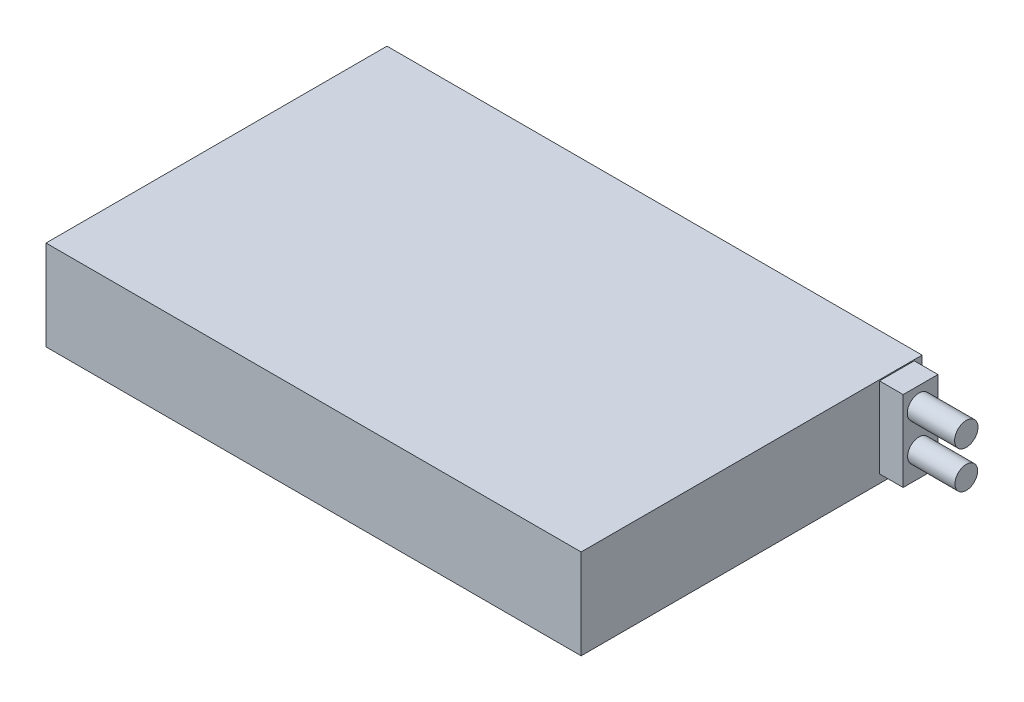
from build123d import *

# Parameters (mm, degrees)
SKETCH_1_W      = 113
SKETCH_1_H      = 72
EXTRUDE_1_DEPTH = 19
SKETCH_2_W      = 7.344019186
SKETCH_2_H      = 17.001907431
EXTRUDE_2_DEPTH = 5
SKETCH_3_R      = 2.471853224
SKETCH_3_R_2    = 2.395721662
EXTRUDE_3_DEPTH = 10


with BuildPart() as part:
    # 草图1 → 凸台-拉伸1 (new body)
    with BuildSketch(Plane(origin=(0, 0, 0), x_dir=(1, 0, 0), z_dir=(0, 1, 0))):
        with Locations((56.5, -36)):
            Rectangle(SKETCH_1_W, SKETCH_1_H)
    extrude(amount=EXTRUDE_1_DEPTH)

    # 草图2 → 凸台-拉伸2 (add)
    with BuildSketch(Plane(origin=(113, 0, 0), x_dir=(0, 0, -1), z_dir=(1, 0, 0))):
        with Locations((-5.329755024, 10.281536394)):
            Rectangle(SKETCH_2_W, SKETCH_2_H)
    extrude(amount=EXTRUDE_2_DEPTH)

    # 草图3 → 凸台-拉伸3 (add)
    with BuildSketch(Plane(origin=(118, 0, 0), x_dir=(0, 0, -1), z_dir=(1, 0, 0))):
        with Locations((-5.672341685, 14.927563873)):
            Circle(SKETCH_3_R)
        with Locations((-5.672341685, 6.978123812)):
            Circle(SKETCH_3_R_2)
    extrude(amount=EXTRUDE_3_DEPTH)


solid = part.part
